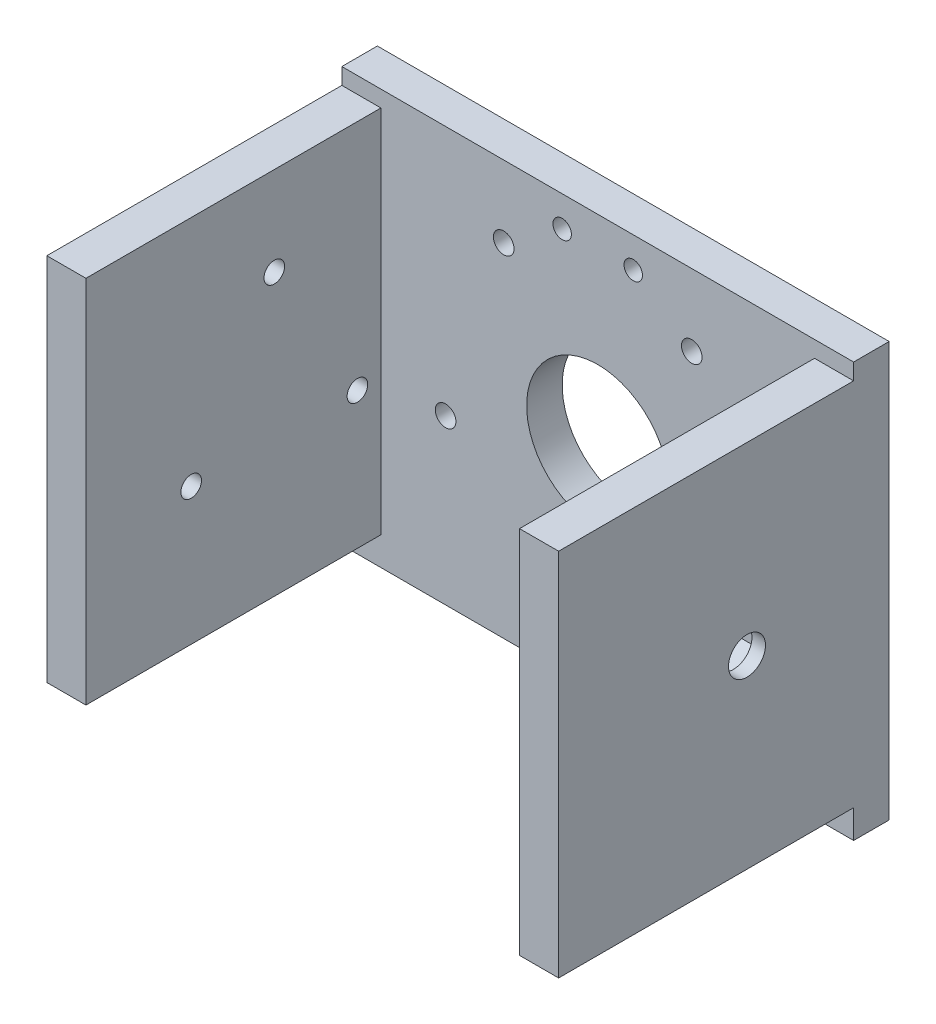
from build123d import *

# Parameters (mm, degrees)
SKETCH1_W           = 72
SKETCH1_H           = 58.3
SKETCH1_R           = 10
SKETCH1_R_2         = 1.45
SKETCH1_R_3         = 1.3
BOSS_EXTRUDE1_DEPTH = 5
SKETCH2_W           = 46.5
SKETCH2_H           = 52
SKETCH2_R           = 1.45
BOSS_EXTRUDE2_DEPTH = 5.5
SKETCH3_R           = 7.6
CUT_EXTRUDE1_DEPTH  = 1.2
SKETCH4_W           = 46.5
SKETCH4_H           = 52
SKETCH4_R           = 2.6
BOSS_EXTRUDE3_DEPTH = 5.5
CUT_EXTRUDE2_DEPTH  = 3.6


with BuildPart() as part:
    # Sketch1 → Boss-Extrude1 (new body)
    with BuildSketch(Plane.XY.offset(280)):
        with Locations((300, 299.15)):
            Rectangle(SKETCH1_W, SKETCH1_H)
        with Locations((300, 300)):
            Circle(SKETCH1_R, mode=Mode.SUBTRACT)
        with Locations((286.774831823, 318.202882373)):
            Circle(SKETCH1_R_2, mode=Mode.SUBTRACT)
        with Locations((278.601228383, 293.047117627)):
            Circle(SKETCH1_R_2, mode=Mode.SUBTRACT)
        with Locations((300, 277.5)):
            Circle(SKETCH1_R_2, mode=Mode.SUBTRACT)
        with Locations((321.398771617, 293.047117627)):
            Circle(SKETCH1_R_2, mode=Mode.SUBTRACT)
        with Locations((313.225168177, 318.202882373)):
            Circle(SKETCH1_R_2, mode=Mode.SUBTRACT)
        with Locations((295, 324)):
            Circle(SKETCH1_R_3, mode=Mode.SUBTRACT)
        with Locations((305, 324)):
            Circle(SKETCH1_R_3, mode=Mode.SUBTRACT)
    extrude(amount=BOSS_EXTRUDE1_DEPTH)

    # Sketch2 → Boss-Extrude2 (add)
    with BuildSketch(Plane(origin=(264, 0, 0), x_dir=(0, 0, -1), z_dir=(1, 0, 0))):
        with Locations((-303.25, 300)):
            Rectangle(SKETCH2_W, SKETCH2_H)
        with Locations((-300, 313.5)):
            Circle(SKETCH2_R, mode=Mode.SUBTRACT)
        with Locations((-288.308657049, 293.25)):
            Circle(SKETCH2_R, mode=Mode.SUBTRACT)
        with Locations((-311.691342951, 293.25)):
            Circle(SKETCH2_R, mode=Mode.SUBTRACT)
    extrude(amount=BOSS_EXTRUDE2_DEPTH)

    # Sketch3 → Cut-Extrude1 (cut)
    with BuildSketch(Plane(origin=(264, 0, 0), x_dir=(0, 0, -1), z_dir=(1, 0, 0))):
        with Locations((-300, 300)):
            Circle(SKETCH3_R)
    extrude(amount=CUT_EXTRUDE1_DEPTH, mode=Mode.SUBTRACT)

    # Sketch4 → Boss-Extrude3 (add)
    with BuildSketch(Plane(origin=(330.5, 0, 0), x_dir=(0, 0, -1), z_dir=(1, 0, 0))):
        with Locations((-303.25, 300)):
            Rectangle(SKETCH4_W, SKETCH4_H)
        with Locations((-300, 300)):
            Circle(SKETCH4_R, mode=Mode.SUBTRACT)
    extrude(amount=BOSS_EXTRUDE3_DEPTH)

    # Sketch5 → Cut-Extrude2 (cut)
    with BuildSketch(Plane(origin=(330.5, 0, 0), x_dir=(0, 0, -1), z_dir=(1, 0, 0))):
        Polygon((-304.1, 302.367136104), (-300, 304.734272207), (-295.9, 302.367136104), (-295.9, 297.632863896), (-300, 295.265727793), (-304.1, 297.632863896), align=None)
    extrude(amount=CUT_EXTRUDE2_DEPTH, mode=Mode.SUBTRACT)


solid = part.part
